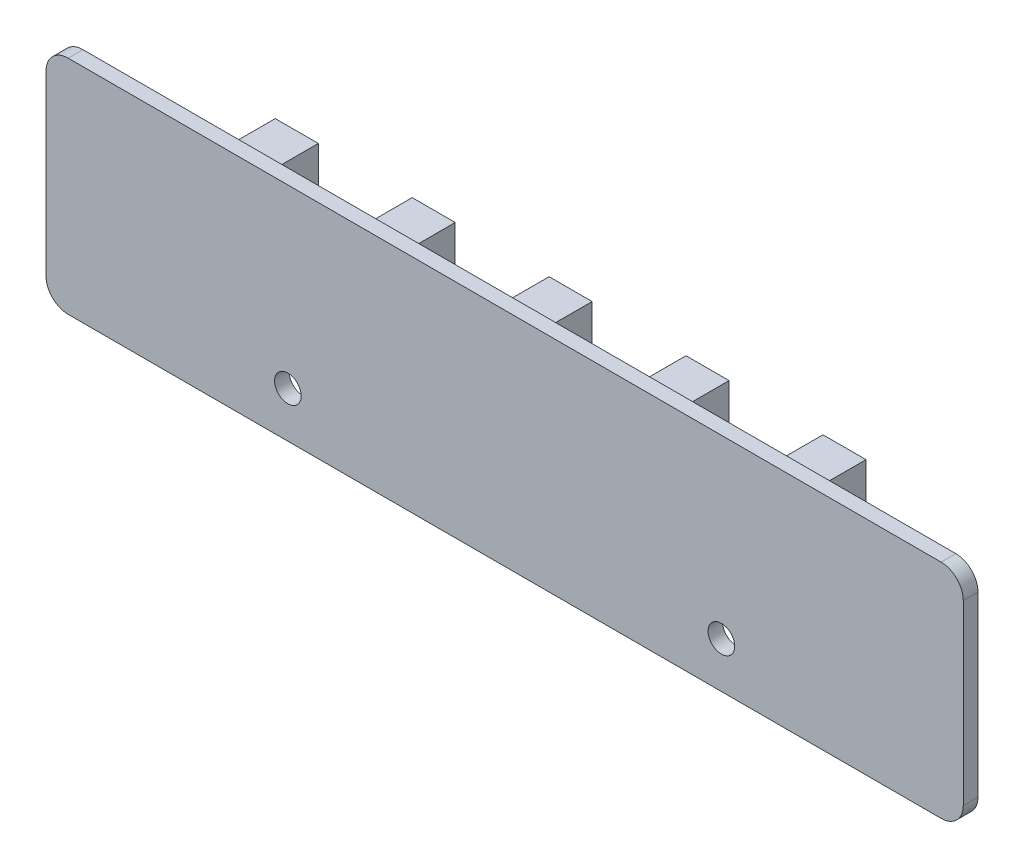
from build123d import *

# Parameters (mm, degrees)
BOSS_EXTRU_1_DEPTH             = 1.99
ESQUISSE3_W                    = 5.82
ESQUISSE3_H                    = 9.63
BOSS_EXTRU_5_DEPTH             = 6.93
R_P_TITION_LIN_AIRE2_COUNT     = 3
R_P_TITION_LIN_AIRE2_PITCH     = 18.509
R_P_TITION_LIN_AIRE2_COL_COUNT = 3
R_P_TITION_LIN_AIRE2_COL_PITCH = 18.509
D_GAGEMENT_M31_D               = 3.6


with BuildPart() as part:
    # Esquisse2 → Boss.-Extru.1 (new body)
    with BuildSketch(Plane.XY):
        with BuildLine():
            Line((-46.628094051, 77.059557029), (71.371905949, 77.059557029))
            ThreePointArc((71.371905949, 77.059557029), (73.493226293, 76.180877372), (74.371905949, 74.059557029))
            Line((74.371905949, 74.059557029), (74.371905949, 50.059557029))
            ThreePointArc((74.371905949, 50.059557029), (73.493226293, 47.938236685), (71.371905949, 47.059557029))
            Line((71.371905949, 47.059557029), (-46.628094051, 47.059557029))
            ThreePointArc((-46.628094051, 47.059557029), (-48.749414394, 47.938236685), (-49.628094051, 50.059557029))
            Line((-49.628094051, 50.059557029), (-49.628094051, 74.059557029))
            ThreePointArc((-49.628094051, 74.059557029), (-48.749414394, 76.180877372), (-46.628094051, 77.059557029))
        make_face()
    extrude(amount=BOSS_EXTRU_1_DEPTH)

    # Esquisse3 → Boss.-Extru.5 (add)
    with BuildSketch(Plane(origin=(0, 0, 0), x_dir=(-1, 0, 0), z_dir=(0, 0, -1))):
        with Locations((-12.371905949, 70.244557029)):
            Rectangle(ESQUISSE3_W, ESQUISSE3_H)
    boss_extru_5 = extrude(amount=BOSS_EXTRU_5_DEPTH)

    # Répétition linéaire2: Boss.-Extru.5 ×3
    with Locations(*[(-i * R_P_TITION_LIN_AIRE2_PITCH, 0, 0) for i in range(1, R_P_TITION_LIN_AIRE2_COUNT)]):
        add(boss_extru_5)

    # Répétition linéaire2 col: Boss.-Extru.5 ×3
    with Locations(*[(i * R_P_TITION_LIN_AIRE2_COL_PITCH, 0, 0) for i in range(1, R_P_TITION_LIN_AIRE2_COL_COUNT)]):
        add(boss_extru_5)

    # Dégagement M31 (through all)
    with Locations(Plane(origin=(0, 0, 0), x_dir=(-1, 0, 0), z_dir=(0, 0, -1))):
        with Locations((-41.671905949, 53.239557029), (16.928094051, 53.239557029)):
            Hole(D_GAGEMENT_M31_D / 2)


solid = part.part
